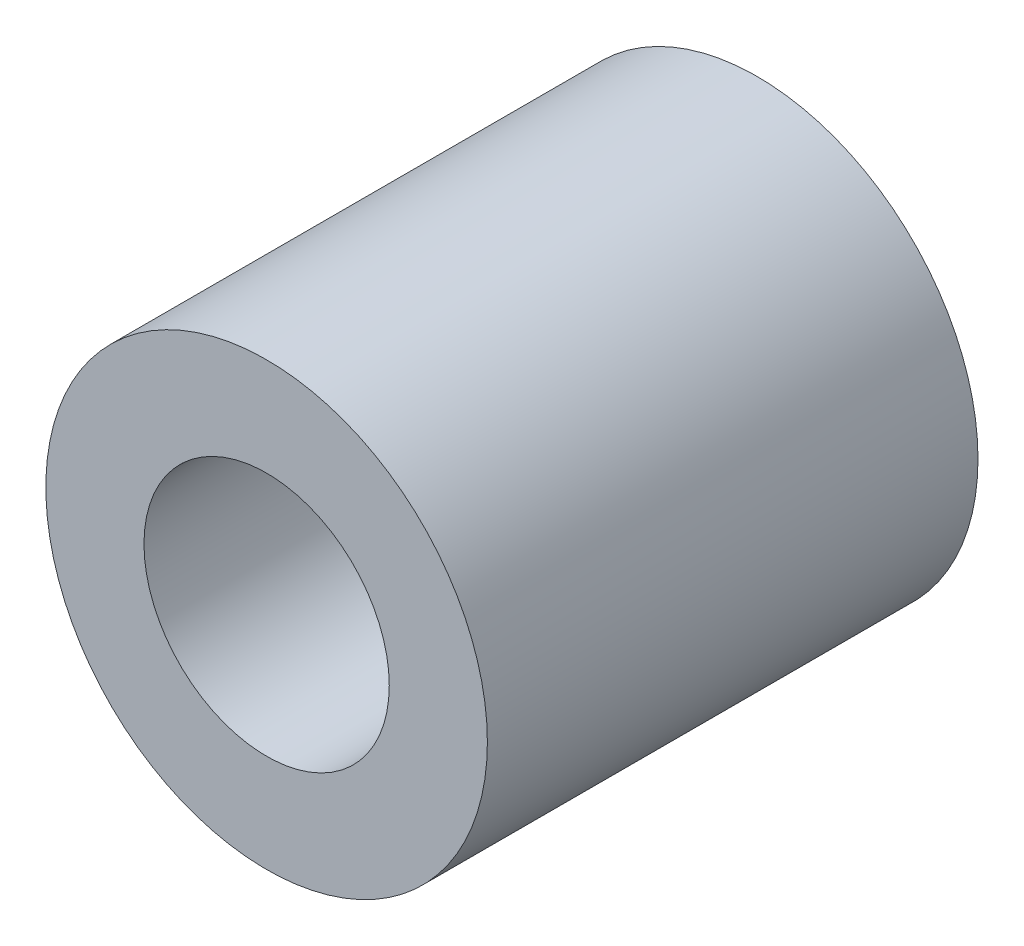
from build123d import *

# Parameters (mm, degrees)
SKETCH1_R           = 4.5
SKETCH1_R_2         = 2.5
BOSS_EXTRUDE1_DEPTH = 10


with BuildPart() as part:
    # Sketch1 → Boss-Extrude1 (new body)
    with BuildSketch(Plane.XY):
        Circle(SKETCH1_R)
        Circle(SKETCH1_R_2, mode=Mode.SUBTRACT)
    extrude(amount=BOSS_EXTRUDE1_DEPTH)


solid = part.part
